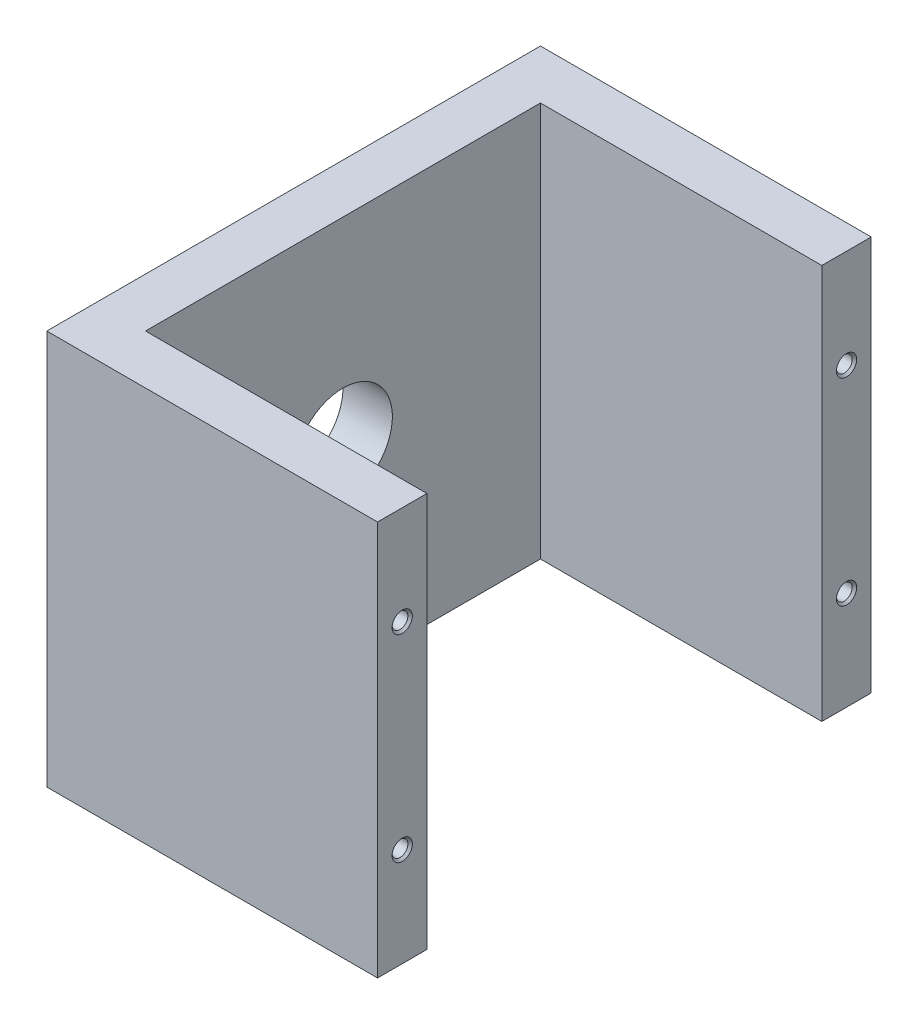
from build123d import *

# Parameters (mm, degrees)
BOSS_EXTRUDE1_DEPTH         = 40
CUT_EXTRUDE1_REACH          = 74.265
SKETCH2_R                   = 5
M2_TAPPED_HOLE2_D           = 1.6
M2_TAPPED_HOLE2_DEPTH       = 5
M2_TAPPED_HOLE2_CSINK_D     = 2.05
M2_TAPPED_HOLE2_CSINK_ANGLE = 90
M2_TAPPED_HOLE2_TIP         = 0.480688495


with BuildPart() as part:
    # Sketch1 → Boss-Extrude1 (new body)
    with BuildSketch(Plane(origin=(0, 0, 0), x_dir=(1, 0, 0), z_dir=(0, 1, 0))):
        Polygon((33.5, 0), (33.5, -5), (5, -5), (5, -45), (33.5, -45), (33.5, -50), (0, -50), (0, 0), align=None)
    extrude(amount=BOSS_EXTRUDE1_DEPTH)

    # Sketch2 → Cut-Extrude1 (cut, up to next)
    with BuildSketch(Plane.ZY, mode=Mode.PRIVATE) as cut_extrude1_sk1:
        with Locations((25, 20)):
            Circle(SKETCH2_R)
    cut_extrude1_tool1 = extrude(cut_extrude1_sk1.sketch, amount=-CUT_EXTRUDE1_REACH, mode=Mode.PRIVATE) & part.part
    add(cut_extrude1_tool1.solids().sort_by_distance((0, 20, 25))[0], mode=Mode.SUBTRACT)

    # M2 Tapped Hole2
    with Locations(Plane(origin=(33.5, 30, 47.5), x_dir=(0, 0, 1), z_dir=(1, 0, 0))):
        with Locations((0, 0), (0, 20), (-45, 20), (-45, 0)):
            CounterSinkHole(M2_TAPPED_HOLE2_D / 2, M2_TAPPED_HOLE2_CSINK_D / 2, depth=M2_TAPPED_HOLE2_DEPTH, counter_sink_angle=M2_TAPPED_HOLE2_CSINK_ANGLE)
            with Locations((0, 0, -(M2_TAPPED_HOLE2_DEPTH + M2_TAPPED_HOLE2_TIP / 2))):  # 118° drill point
                Cone(0, M2_TAPPED_HOLE2_D / 2, M2_TAPPED_HOLE2_TIP, mode=Mode.SUBTRACT)


solid = part.part
